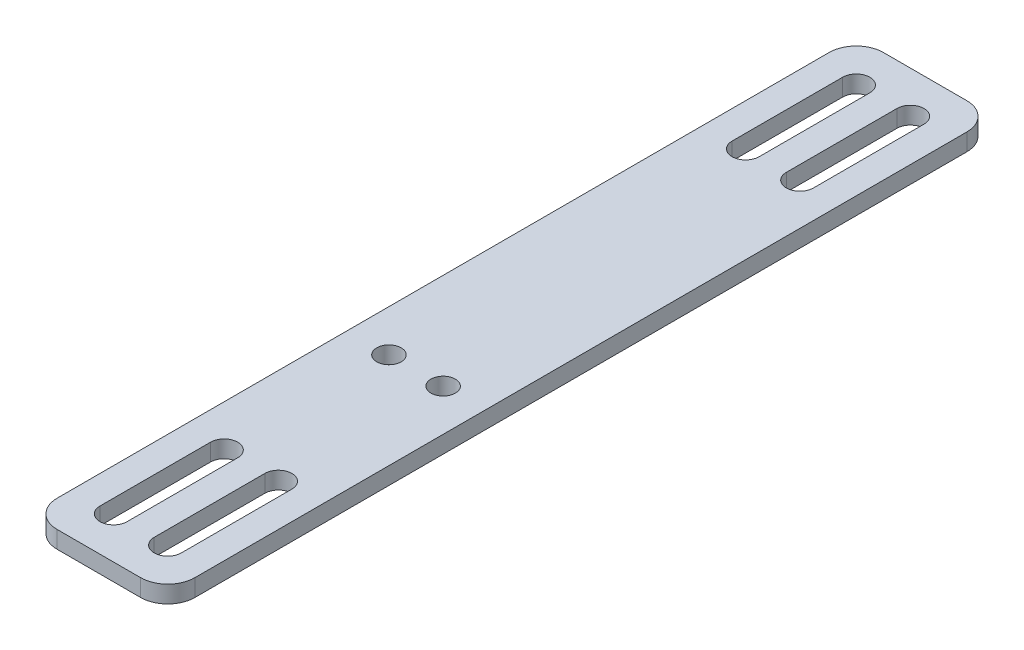
from build123d import *

# Parameters (mm, degrees)
BOSS_EXTRUDE1_DEPTH      = 76.2
BOSS_EXTRUDE1_DEPTH_BACK = 76.2
SKETCH3_W                = 25.4
SKETCH3_H                = 3.175
CUT_EXTRUDE2_DEPTH       = 3.175
FILLET1_R                = 5
M4_CLEARANCE_HOLE1_D     = 4.5


with BuildPart() as part:
    # Sketch3 → Boss-Extrude1 (new, two sides: drawn at the far end of the back side and taken through both)
    with BuildSketch(Plane.XY.offset(-BOSS_EXTRUDE1_DEPTH_BACK)):
        Rectangle(SKETCH3_W, SKETCH3_H)
    extrude(amount=BOSS_EXTRUDE1_DEPTH + BOSS_EXTRUDE1_DEPTH_BACK)

    # Sketch5 → Cut-Extrude2 (cut)
    with BuildSketch(Plane(origin=(0, -1.5875, 0), x_dir=(-1, 0, 0), z_dir=(0, -1, 0))):
        with BuildLine():
            Line((7.5, -48.1), (7.5, -68.5))
            ThreePointArc((7.5, -68.5), (5, -71), (2.5, -68.5))
            Line((2.5, -68.5), (2.5, -48.1))
            ThreePointArc((2.5, -48.1), (5, -45.6), (7.5, -48.1))
        make_face()
        with BuildLine():
            Line((-2.5, -48.1), (-2.5, -68.5))
            ThreePointArc((-2.5, -68.5), (-5, -71), (-7.5, -68.5))
            Line((-7.5, -68.5), (-7.5, -48.1))
            ThreePointArc((-7.5, -48.1), (-5, -45.6), (-2.5, -48.1))
        make_face()
    cut_extrude2 = extrude(amount=-CUT_EXTRUDE2_DEPTH, mode=Mode.SUBTRACT)

    # Mirror1: Cut-Extrude2 across plane
    add(cut_extrude2.mirror(Plane.XY), mode=Mode.SUBTRACT)

    # Fillet1
    fillet1_edges = [part.edges().sort_by_distance(p)[0] for p in [
        (12.7, 0, 76.2),
        (-12.7, 0, -76.2),
        (12.7, 0, -76.2),
        (-12.7, 0, 76.2),
    ]]
    fillet(fillet1_edges, radius=FILLET1_R)

    # M4 Clearance Hole1 (through all)
    with Locations(Plane(origin=(0, 1.5875, 0), x_dir=(1, 0, 0), z_dir=(0, 1, 0))):
        with Locations((5, -17.7), (-5, -17.7)):
            Hole(M4_CLEARANCE_HOLE1_D / 2)


solid = part.part
